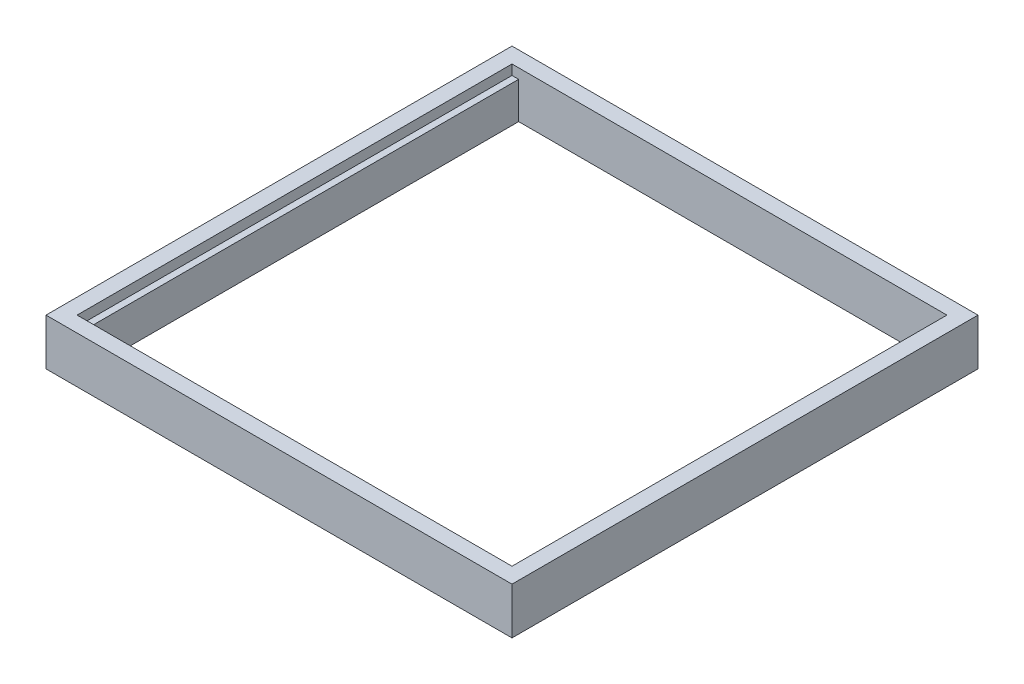
from build123d import *

# Parameters (mm, degrees)
SKETCH1_W             = 75
SKETCH1_H             = 75
BASE_DEPTH            = 7.5
SKETCH2_W             = 70
SKETCH2_H             = 70
SLOT_DEPTH            = 1.6
SKETCH3_W             = 67.858008496
SKETCH3_H             = 70
SLOT_COMPONENTS_DEPTH = 5.9


with BuildPart() as part:
    # Sketch1 → Base (new body)
    with BuildSketch(Plane(origin=(0, 0, 0), x_dir=(1, 0, 0), z_dir=(0, 1, 0))):
        Rectangle(SKETCH1_W, SKETCH1_H)
    extrude(amount=BASE_DEPTH)

    # Sketch2 → Slot (cut)
    with BuildSketch(Plane(origin=(0, 7.5, 0), x_dir=(1, 0, 0), z_dir=(0, 1, 0))):
        Rectangle(SKETCH2_W, SKETCH2_H)
    extrude(amount=-SLOT_DEPTH, mode=Mode.SUBTRACT)

    # Sketch3 → Slot-Components (cut)
    with BuildSketch(Plane(origin=(0, 5.9, 0), x_dir=(1, 0, 0), z_dir=(0, 1, 0))):
        Rectangle(SKETCH3_W, SKETCH3_H)
    extrude(amount=-SLOT_COMPONENTS_DEPTH, mode=Mode.SUBTRACT)


solid = part.part
